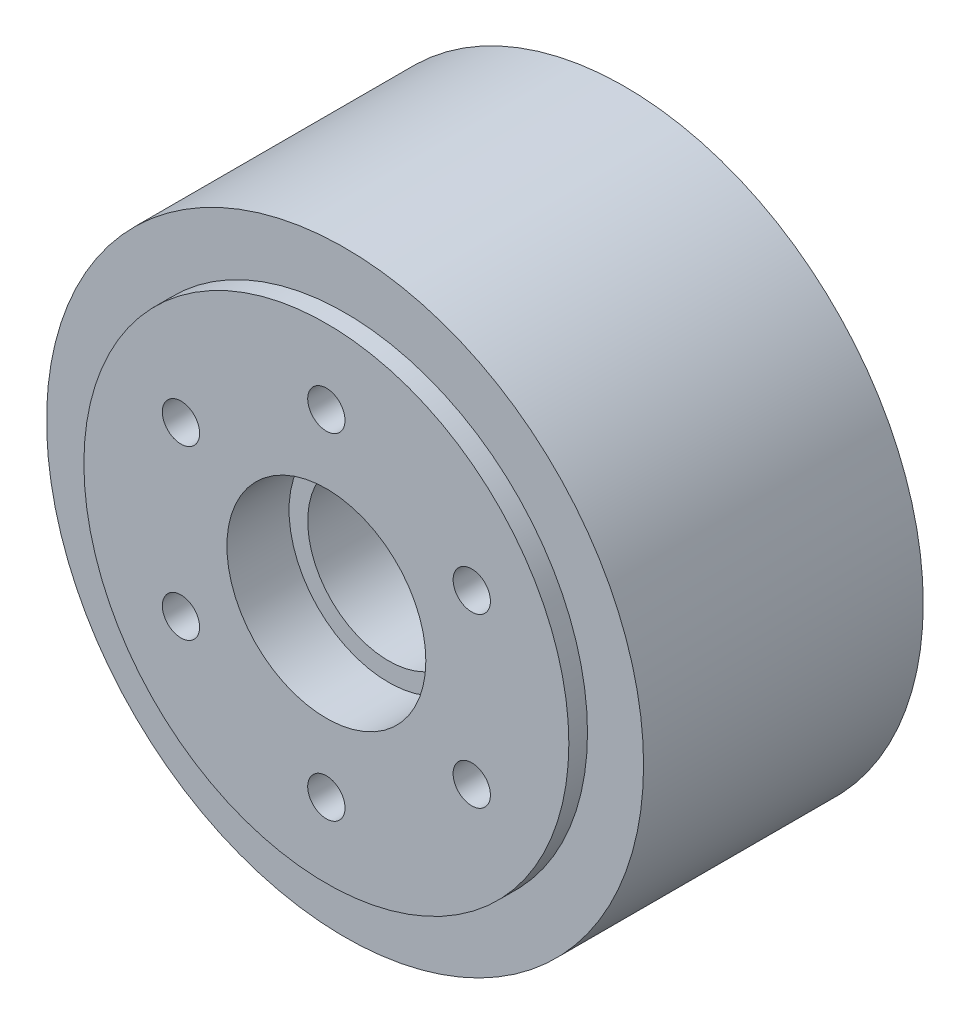
from build123d import *

# Parameters (mm, degrees)
SKETCH2_W          = 44.98
SKETCH2_H          = 12
SKETCH3_R          = 3
CUT_EXTRUDE1_DEPTH = 84.14998617


with BuildPart() as part:
    # Sketch1 → Revolve1 (revolve)
    with BuildSketch(Plane(origin=(0, 0, 0), x_dir=(0, 0, -1), z_dir=(1, 0, 0)), mode=Mode.PRIVATE) as revolve1_sk:
        Polygon((0, 16), (0, 39), (3, 39), (3, 36), (48, 36), (48, 16), (38, 16), (38, 13), (10, 13), (10, 16), align=None)
    revolve(revolve1_sk.sketch.rotate(Axis((0, 0, 0), (0, 0, -1)), 90), axis=Axis((0, 0, 0), (0, 0, -1)))

    # Sketch3 → Cut-Extrude1 (cut, through all)
    with BuildSketch(Plane.XY):
        with Locations((0, 27)):
            Circle(SKETCH3_R)
        with Locations((23.382685902, 13.5)):
            Circle(SKETCH3_R)
        with Locations((23.382685902, -13.5)):
            Circle(SKETCH3_R)
        with Locations((0, -27)):
            Circle(SKETCH3_R)
        with Locations((-23.382685902, -13.5)):
            Circle(SKETCH3_R)
        with Locations((-23.382685902, 13.5)):
            Circle(SKETCH3_R)
    extrude(amount=-CUT_EXTRUDE1_DEPTH, mode=Mode.SUBTRACT)


with BuildPart() as body_2:
    # Sketch2 → Revolve2 (revolve)
    with BuildSketch(Plane(origin=(0, 0, 0), x_dir=(0, 0, -1), z_dir=(1, 0, 0)), mode=Mode.PRIVATE) as revolve2_sk:
        with Locations((25.5, 42.01)):
            Rectangle(SKETCH2_W, SKETCH2_H)
    revolve(revolve2_sk.sketch.rotate(Axis((0, 0, 0), (0, 0, -1)), 90), axis=Axis((0, 0, 0), (0, 0, -1)))


solid = Compound([part.part, body_2.part])
